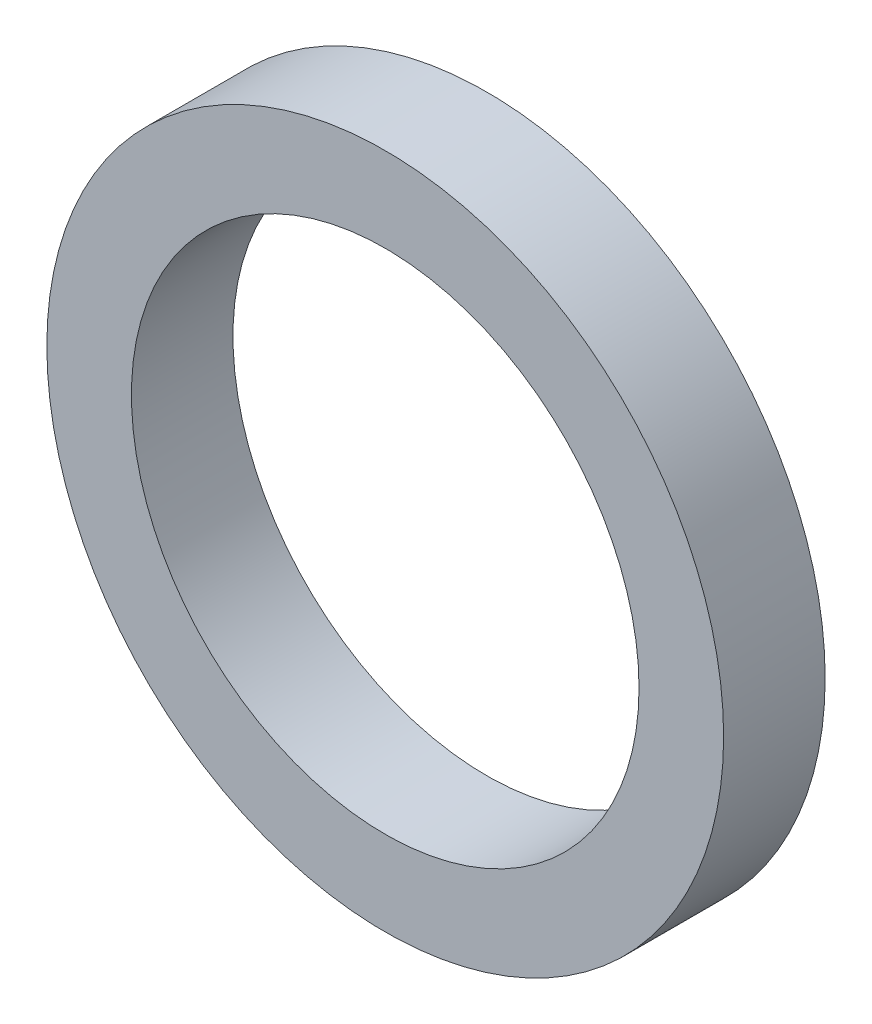
from build123d import *

# Parameters (mm, degrees)
SKETCH_1_R      = 20
SKETCH_1_R_2    = 15
EXTRUDE_1_DEPTH = 6


with BuildPart() as part:
    # 草图1 → 凸台-拉伸1 (new body)
    with BuildSketch(Plane.XY):
        Circle(SKETCH_1_R)
        Circle(SKETCH_1_R_2, mode=Mode.SUBTRACT)
    extrude(amount=EXTRUDE_1_DEPTH)


solid = part.part
